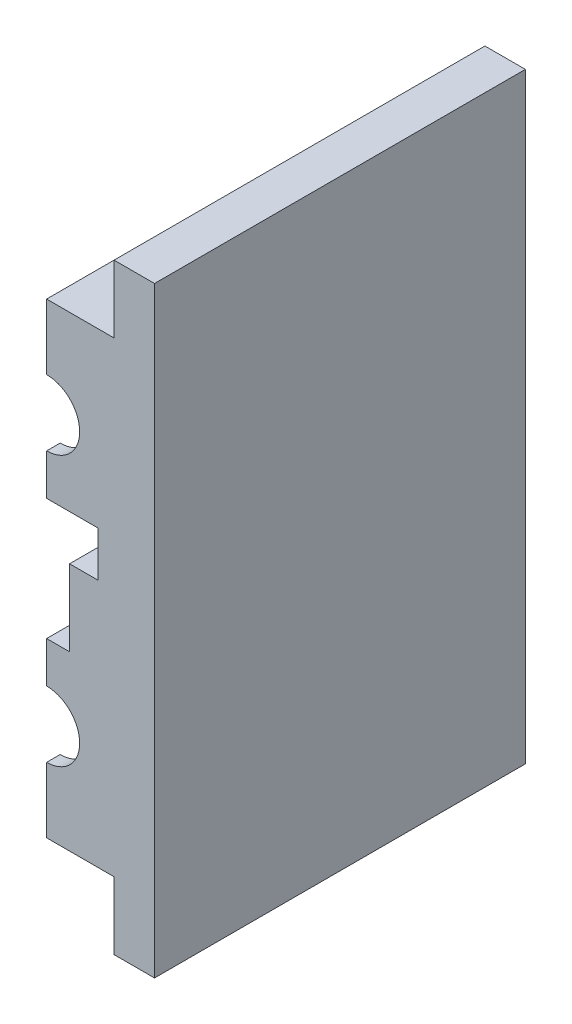
from build123d import *

# Parameters (mm, degrees)
BOSS_EXTRUDE1_DEPTH = 55
BOSS_EXTRUDE2_START = 2
BOSS_EXTRUDE2_DEPTH = 2
BOSS_EXTRUDE3_START = 2
BOSS_EXTRUDE3_DEPTH = 2
BOSS_EXTRUDE5_START = 2
BOSS_EXTRUDE5_DEPTH = 2
BOSS_EXTRUDE6_DEPTH = 2
SKETCH7_W           = 3.4
SKETCH7_H           = 11.3
CUT_EXTRUDE2_DEPTH  = 55


with BuildPart() as part:
    # Sketch1 → Boss-Extrude1 (new body)
    with BuildSketch(Plane.XY):
        with BuildLine():
            Line((0, 0), (0, -89.2))
            Line((0, -89.2), (-6, -89.2))
            Line((-6, -89.2), (-6, -79.2))
            Line((-6, -79.2), (-16, -79.2))
            Line((-16, -79.2), (-16, -72.2))
            ThreePointArc((-16, -72.2), (-8.4, -64.6), (-16, -57))
            Line((-16, -57), (-16, -42.3))
            Line((-16, -42.3), (-8.4, -42.3))
            Line((-8.4, -42.3), (-8.4, -35.6))
            Line((-8.4, -35.6), (-16, -35.6))
            Line((-16, -35.6), (-16, -32.2))
            ThreePointArc((-16, -32.2), (-8.4, -24.6), (-16, -17))
            Line((-16, -17), (-16, -10))
            Line((-16, -10), (-6, -10))
            Line((-6, -10), (-6, 0))
            Line((-6, 0), (0, 0))
        make_face()
    extrude(amount=BOSS_EXTRUDE1_DEPTH)

    # Sketch2 → Boss-Extrude2 (add)
    with BuildSketch(Plane(origin=(0, 0, 28.5), x_dir=(-1, 0, 0), z_dir=(0, 0, -1)).offset(BOSS_EXTRUDE2_START)):
        with BuildLine():
            Line((16, -32.2), (16, -29.5))
            ThreePointArc((16, -29.5), (11.1, -24.6), (16, -19.7))
            Line((16, -19.7), (16, -17))
            ThreePointArc((16, -17), (8.4, -24.6), (16, -32.2))
        make_face()
    extrude(amount=-BOSS_EXTRUDE2_DEPTH)

    # Sketch3 → Boss-Extrude3 (add)
    with BuildSketch(Plane(origin=(0, 0, 28.5), x_dir=(-1, 0, 0), z_dir=(0, 0, -1)).offset(BOSS_EXTRUDE3_START)):
        with BuildLine():
            Line((16, -72.2), (16, -69.5))
            ThreePointArc((16, -69.5), (11.1, -64.6), (16, -59.7))
            Line((16, -59.7), (16, -57))
            ThreePointArc((16, -57), (8.4, -64.6), (16, -72.2))
        make_face()
    extrude(amount=-BOSS_EXTRUDE3_DEPTH)

    # Sketch4 → Boss-Extrude5 (add)
    with BuildSketch(Plane(origin=(0, 0, 2), x_dir=(-1, 0, 0), z_dir=(0, 0, -1)).offset(BOSS_EXTRUDE5_START)):
        with BuildLine():
            Line((16, -57), (16, -59.7))
            ThreePointArc((16, -59.7), (11.1, -64.6), (16, -69.5))
            Line((16, -69.5), (16, -72.2))
            ThreePointArc((16, -72.2), (8.4, -64.6), (16, -57))
        make_face()
        with BuildLine():
            Line((16, -17), (16, -19.7))
            ThreePointArc((16, -19.7), (11.1, -24.6), (16, -29.5))
            Line((16, -29.5), (16, -32.2))
            ThreePointArc((16, -32.2), (8.4, -24.6), (16, -17))
        make_face()
    extrude(amount=-BOSS_EXTRUDE5_DEPTH)

    # Sketch5 → Boss-Extrude6 (add)
    with BuildSketch(Plane(origin=(0, 0, 53), x_dir=(-1, 0, 0), z_dir=(0, 0, -1))):
        with BuildLine():
            Line((16, -17), (16, -19.7))
            ThreePointArc((16, -19.7), (11.1, -24.6), (16, -29.5))
            Line((16, -29.5), (16, -32.2))
            ThreePointArc((16, -32.2), (8.4, -24.6), (16, -17))
        make_face()
        with BuildLine():
            Line((16, -57), (16, -59.7))
            ThreePointArc((16, -59.7), (11.1, -64.6), (16, -69.5))
            Line((16, -69.5), (16, -72.2))
            ThreePointArc((16, -72.2), (8.4, -64.6), (16, -57))
        make_face()
    extrude(amount=-BOSS_EXTRUDE6_DEPTH)

    # Sketch7 → Cut-Extrude2 (cut)
    with BuildSketch(Plane.XY.offset(55)):
        with Locations((-14.3, -47.95)):
            Rectangle(SKETCH7_W, SKETCH7_H)
    extrude(amount=-CUT_EXTRUDE2_DEPTH, mode=Mode.SUBTRACT)


solid = part.part
